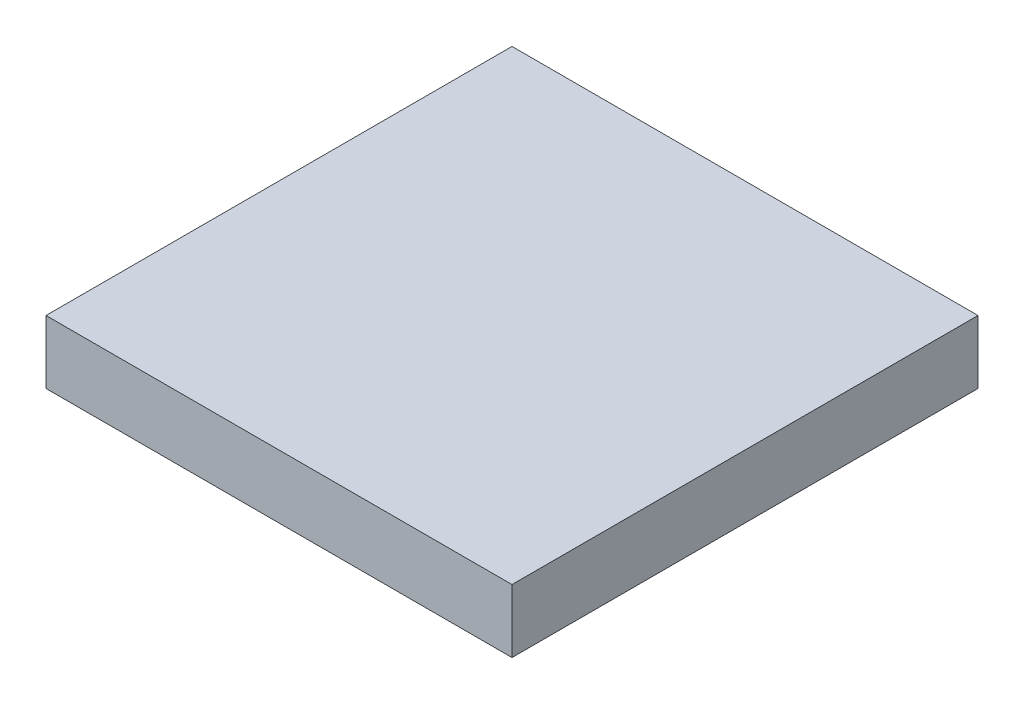
from build123d import *

# Parameters (mm, degrees)
SKETCH_1_W      = 14
SKETCH_1_H      = 14
EXTRUDE_1_DEPTH = 1.9


with BuildPart() as part:
    # 草图1 → 凸台-拉伸1 (new body)
    with BuildSketch(Plane(origin=(0, 0, 0), x_dir=(1, 0, 0), z_dir=(0, 1, 0))):
        Rectangle(SKETCH_1_W, SKETCH_1_H)
    extrude(amount=EXTRUDE_1_DEPTH)


solid = part.part
